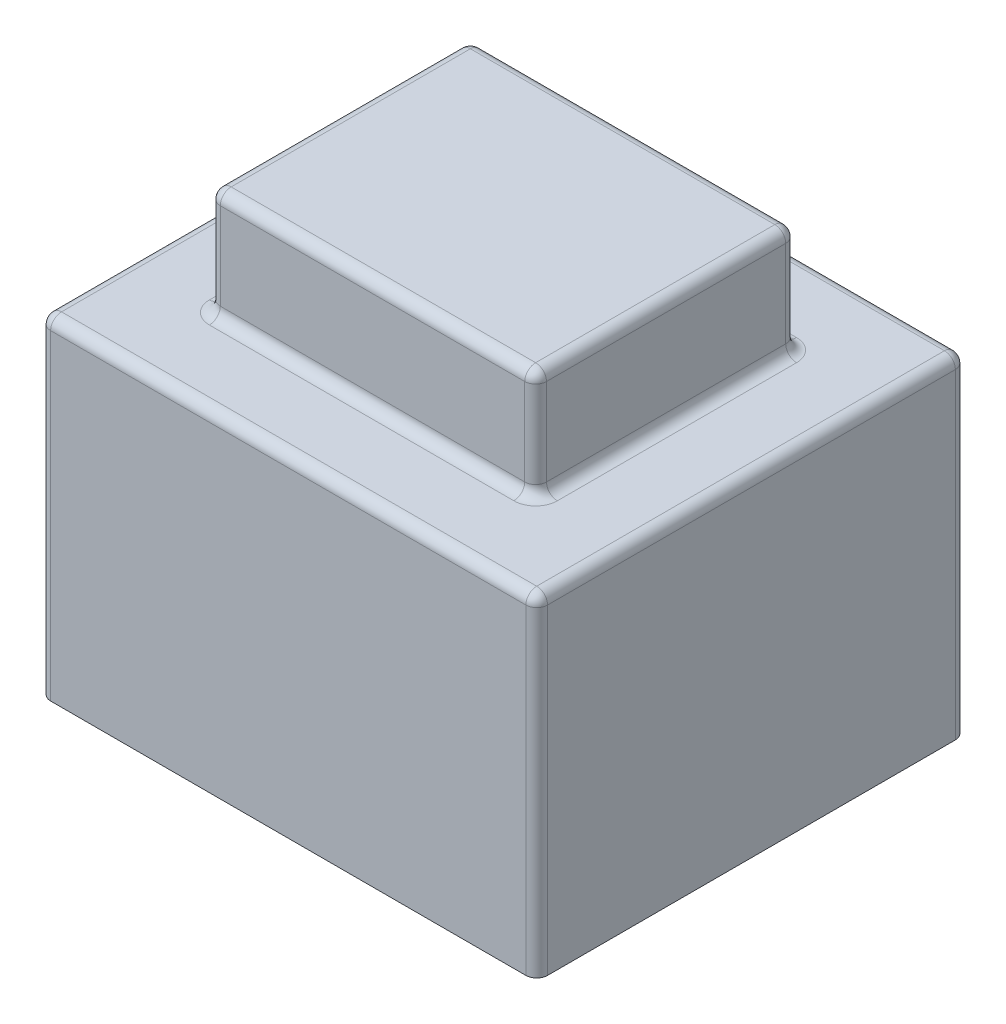
from build123d import *

# Parameters (mm, degrees)
EXTRUDE_START      = -0.5
SKETCH_1_W         = 1
SKETCH_1_H         = 2
EXTRUDE_1_DEPTH    = 1.5
EXTRUDE_1_2_DEPTH  = 1.5
EXTRUDE_1_3_DEPTH  = 1.5
EXTRUDE_1_4_DEPTH  = 1.5
EXTRUDE_1_5_DEPTH  = 1.5
EXTRUDE_1_6_DEPTH  = 1.5
EXTRUDE_1_7_DEPTH  = 1.5
EXTRUDE_1_8_DEPTH  = 1.5
EXTRUDE_1_9_DEPTH  = 1.5
EXTRUDE_1_10_DEPTH = 1.5
SKETCH_2_W         = 45.7
SKETCH_2_H         = 39.5
EXTRUDE_2_DEPTH    = 30.5
SKETCH_3_W         = 30
SKETCH_3_H         = 24
EXTRUDE_3_DEPTH    = 10
FILLET_1_R         = 1


with BuildPart() as part:
    # Эскиз1 → Бобышка-Вытянуть1 (new body)
    with BuildSketch(Plane(origin=(0, 0, 0), x_dir=(1, 0, 0), z_dir=(0, 1, 0)).offset(EXTRUDE_START)):
        with Locations((-5, 12.5)):
            Rectangle(SKETCH_1_W, SKETCH_1_H)
    extrude(amount=EXTRUDE_1_DEPTH)


with BuildPart() as body_2:
    # Эскиз1 → Extrude 1 2 (new body)
    with BuildSketch(Plane(origin=(0, 0, 0), x_dir=(1, 0, 0), z_dir=(0, 1, 0)).offset(EXTRUDE_START)):
        with Locations((-10, 12.5)):
            Rectangle(SKETCH_1_W, SKETCH_1_H)
    extrude(amount=EXTRUDE_1_2_DEPTH)


with BuildPart() as body_3:
    # Эскиз1 → Extrude 1 3 (new body)
    with BuildSketch(Plane(origin=(0, 0, 0), x_dir=(1, 0, 0), z_dir=(0, 1, 0)).offset(EXTRUDE_START)):
        with Locations((0, 12.5)):
            Rectangle(SKETCH_1_W, SKETCH_1_H)
    extrude(amount=EXTRUDE_1_3_DEPTH)


with BuildPart() as body_4:
    # Эскиз1 → Extrude 1 4 (new body)
    with BuildSketch(Plane(origin=(0, 0, 0), x_dir=(1, 0, 0), z_dir=(0, 1, 0)).offset(EXTRUDE_START)):
        with Locations((5, 12.5)):
            Rectangle(SKETCH_1_W, SKETCH_1_H)
    extrude(amount=EXTRUDE_1_4_DEPTH)


with BuildPart() as body_5:
    # Эскиз1 → Extrude 1 5 (new body)
    with BuildSketch(Plane(origin=(0, 0, 0), x_dir=(1, 0, 0), z_dir=(0, 1, 0)).offset(EXTRUDE_START)):
        with Locations((10, 12.5)):
            Rectangle(SKETCH_1_W, SKETCH_1_H)
    extrude(amount=EXTRUDE_1_5_DEPTH)


with BuildPart() as body_6:
    # Эскиз1 → Extrude 1 6 (new body)
    with BuildSketch(Plane(origin=(0, 0, 0), x_dir=(1, 0, 0), z_dir=(0, 1, 0)).offset(EXTRUDE_START)):
        with Locations((-5, -12.5)):
            Rectangle(SKETCH_1_W, SKETCH_1_H)
    extrude(amount=EXTRUDE_1_6_DEPTH)


with BuildPart() as body_7:
    # Эскиз1 → Extrude 1 7 (new body)
    with BuildSketch(Plane(origin=(0, 0, 0), x_dir=(1, 0, 0), z_dir=(0, 1, 0)).offset(EXTRUDE_START)):
        with Locations((0, -12.5)):
            Rectangle(SKETCH_1_W, SKETCH_1_H)
    extrude(amount=EXTRUDE_1_7_DEPTH)


with BuildPart() as body_8:
    # Эскиз1 → Extrude 1 8 (new body)
    with BuildSketch(Plane(origin=(0, 0, 0), x_dir=(1, 0, 0), z_dir=(0, 1, 0)).offset(EXTRUDE_START)):
        with Locations((5, -12.5)):
            Rectangle(SKETCH_1_W, SKETCH_1_H)
    extrude(amount=EXTRUDE_1_8_DEPTH)


with BuildPart() as body_9:
    # Эскиз1 → Extrude 1 9 (new body)
    with BuildSketch(Plane(origin=(0, 0, 0), x_dir=(1, 0, 0), z_dir=(0, 1, 0)).offset(EXTRUDE_START)):
        with Locations((10, -12.5)):
            Rectangle(SKETCH_1_W, SKETCH_1_H)
    extrude(amount=EXTRUDE_1_9_DEPTH)


with BuildPart() as body_10:
    # Эскиз1 → Extrude 1 10 (new body)
    with BuildSketch(Plane(origin=(0, 0, 0), x_dir=(1, 0, 0), z_dir=(0, 1, 0)).offset(EXTRUDE_START)):
        with Locations((-10, -12.5)):
            Rectangle(SKETCH_1_W, SKETCH_1_H)
    extrude(amount=EXTRUDE_1_10_DEPTH)


with BuildPart() as body_11:
    # Эскиз2 → Бобышка-Вытянуть2 (new body)
    with BuildSketch(Plane(origin=(0, 1, 0), x_dir=(1, 0, 0), z_dir=(0, 1, 0))):
        Rectangle(SKETCH_2_W, SKETCH_2_H)
    extrude(amount=EXTRUDE_2_DEPTH)

    # Эскиз3 → Бобышка-Вытянуть3 (add)
    with BuildSketch(Plane(origin=(0, 31.5, 0), x_dir=(1, 0, 0), z_dir=(0, 1, 0))):
        Rectangle(SKETCH_3_W, SKETCH_3_H)
    extrude(amount=EXTRUDE_3_DEPTH)

    # Скругление1
    fillet_1_edges = [body_11.edges().sort_by_distance(p)[0] for p in [
        (22.85, 31.5, 0),
        (0, 31.5, -19.75),
        (-15, 31.5, 0),
        (-15, 36.5, -12),
        (0, 31.5, 12),
        (-15, 36.5, 12),
        (15, 31.5, 0),
        (15, 36.5, 12),
        (0, 31.5, -12),
        (15, 36.5, -12),
        (-15, 41.5, 0),
        (0, 41.5, 12),
        (15, 41.5, 0),
        (0, 41.5, -12),
        (-22.85, 31.5, 0),
        (0, 31.5, 19.75),
        (-22.85, 16.25, -19.75),
        (22.85, 16.25, -19.75),
        (22.85, 16.25, 19.75),
        (-22.85, 16.25, 19.75),
    ]]
    fillet(fillet_1_edges, radius=FILLET_1_R)


solid = Compound([part.part, body_2.part, body_3.part, body_4.part, body_5.part, body_6.part, body_7.part, body_8.part, body_9.part, body_10.part, body_11.part])
